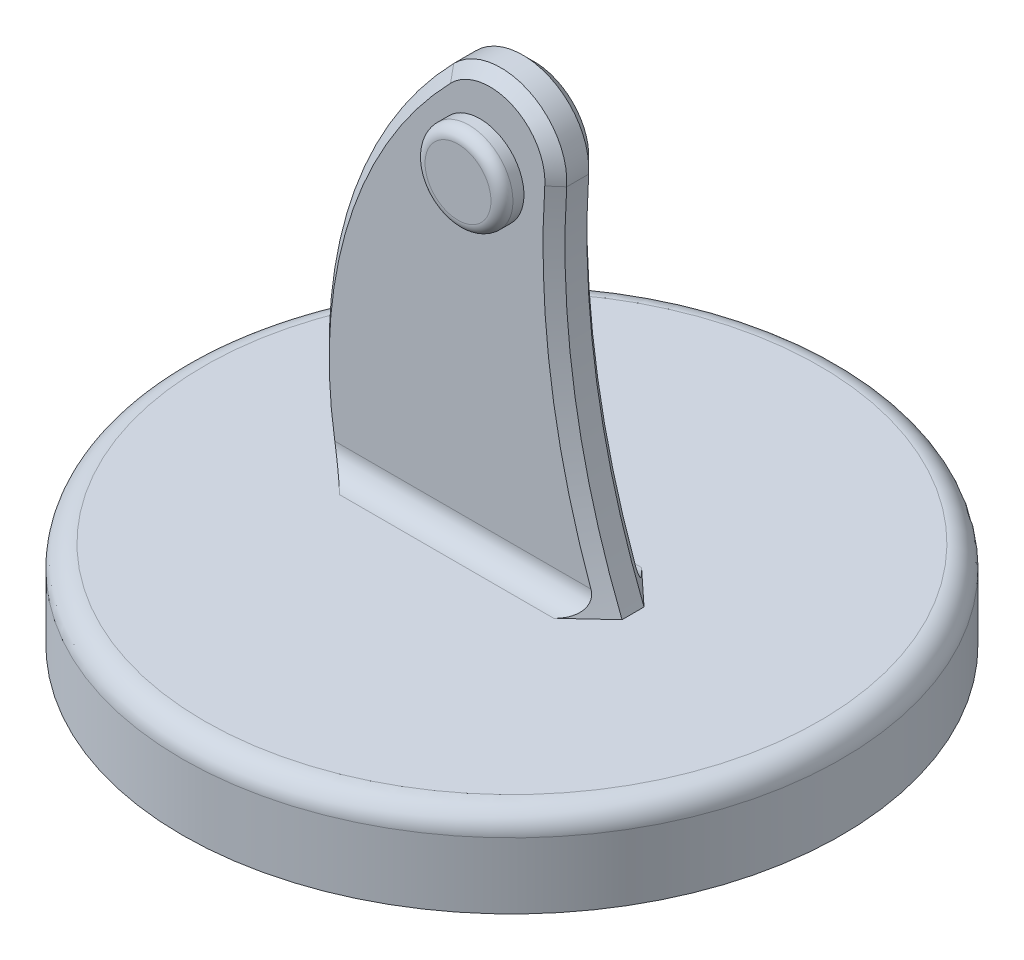
from build123d import *

# Parameters (mm, degrees)
SKETCH1_R           = 75
BOSS_EXTRUDE1_DEPTH = 20
FILLET1_R           = 5
BOSS_EXTRUDE2_DEPTH = 5
CHAMFER2_SIZE       = 2.5
CHAMFER3_SIZE       = 2.5
FILLET2_R           = 5
SKETCH3_R           = 10
BOSS_EXTRUDE4_DEPTH = 5
FILLET5_R           = 2.5
SKETCH5_R           = 5
CUT_EXTRUDE4_DEPTH  = 10


with BuildPart() as part:
    # Sketch1 → Boss-Extrude1 (new body)
    with BuildSketch(Plane(origin=(0, 0, 0), x_dir=(1, 0, 0), z_dir=(0, 1, 0))):
        with Locations(Location((0, 0, 0), (0, 0, 270))):
            Circle(SKETCH1_R)
    extrude(amount=BOSS_EXTRUDE1_DEPTH)

    # Fillet1
    fillet1_edges = [part.edges().sort_by_distance(p)[0] for p in [
        (0, 20, -75),
    ]]
    fillet(fillet1_edges, radius=FILLET1_R)

    # Sketch2 → Boss-Extrude2 (add, symmetric)
    with BuildSketch(Plane.XY):
        with BuildLine():
            Line((-35, 12.444541462), (30, 12.444541462))
            Line((30, 12.444541462), (30, 14.22534194))
            ThreePointArc((30, 14.22534194), (17.339153051, 55.705537473), (14.967295478, 99.010017132))
            ThreePointArc((14.967295478, 99.010017132), (6.101321608, 113.703060776), (-10.750360925, 110.460867076))
            ThreePointArc((-10.750360925, 110.460867076), (-36.154540949, 64.738072262), (-35, 12.444541462))
        make_face()
    extrude(amount=BOSS_EXTRUDE2_DEPTH, both=True)

    # Chamfer2
    chamfer2_edges = [part.edges().sort_by_distance(p)[0] for p in [
        (16.818841315, 58.796417799, 5),
        (6.101321608, 113.703060776, 5),
        (-35.144979175, 68.502452567, 5),
    ]]
    chamfer(chamfer2_edges, length=CHAMFER2_SIZE)

    # Chamfer3
    chamfer3_edges = [part.edges().sort_by_distance(p)[0] for p in [
        (-35.144979175, 68.502452567, -5),
        (16.818841315, 58.796417799, -5),
        (6.101321608, 113.703060776, -5),
    ]]
    chamfer(chamfer3_edges, length=CHAMFER3_SIZE)

    # Fillet2
    fillet2_edges = [part.edges().sort_by_distance(p)[0] for p in [
        (-4.741993221, 20, 5),
        (-4.741993221, 20, -5),
    ]]
    fillet(fillet2_edges, radius=FILLET2_R)

    # Sketch3 → Boss-Extrude4 (add)
    with BuildSketch(Plane.XY.offset(5)):
        with Locations(Location((-2.266839378, 95.064766839, 0), (0, 0, 180))):
            Circle(SKETCH3_R)
    extrude(amount=BOSS_EXTRUDE4_DEPTH)

    # Fillet5
    fillet5_edges = [part.edges().sort_by_distance(p)[0] for p in [
        (7.733160622, 95.064766839, 10),
    ]]
    fillet(fillet5_edges, radius=FILLET5_R)

    # Sketch5 → Cut-Extrude4 (cut)
    with BuildSketch(Plane(origin=(0, 0, -5), x_dir=(-1, 0, 0), z_dir=(0, 0, -1))):
        with Locations((2.460107282, 95.761056281)):
            Circle(SKETCH5_R)
    extrude(amount=-CUT_EXTRUDE4_DEPTH, mode=Mode.SUBTRACT)


solid = part.part
